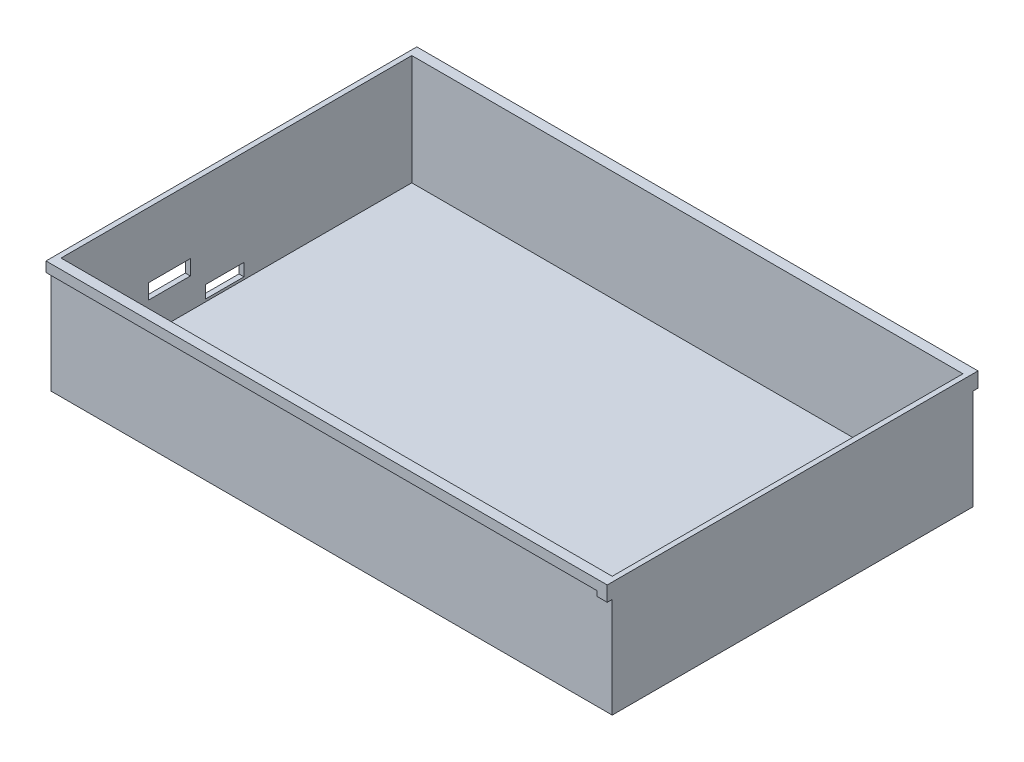
from build123d import *

# Parameters (mm, degrees)
CROQUIS1_W              = 112
CROQUIS1_H              = 72
SALIENTE_EXTRUIR1_DEPTH = 1
SALIENTE_EXTRUIR2_DEPTH = 1
CROQUIS3_W              = 72
CROQUIS3_H              = 23
SALIENTE_EXTRUIR3_DEPTH = 1
CROQUIS4_W              = 112
CROQUIS4_H              = 23
SALIENTE_EXTRUIR4_DEPTH = 1
CROQUIS5_W              = 112
CROQUIS5_H              = 23
SALIENTE_EXTRUIR5_DEPTH = 1
CROQUIS6_W              = 7.7
CROQUIS6_H              = 2.5
CROQUIS6_W_2            = 8.3
CROQUIS6_H_2            = 3
CORTAR_EXTRUIR1_DEPTH   = 1
SALIENTE_EXTRUIR6_DEPTH = 1
SALIENTE_EXTRUIR7_DEPTH = 1


with BuildPart() as part:
    # Croquis1 → Saliente-Extruir1 (new body)
    with BuildSketch(Plane(origin=(0, 0, 0), x_dir=(1, 0, 0), z_dir=(0, 1, 0))):
        with Locations((56, 36)):
            Rectangle(CROQUIS1_W, CROQUIS1_H)
    extrude(amount=SALIENTE_EXTRUIR1_DEPTH)

    # Croquis2 → Saliente-Extruir2 (add)
    with BuildSketch(Plane.ZY):
        Polygon((0, 0), (0, 23), (-72.007399111, 23), (-72, 0), align=None)
    extrude(amount=-SALIENTE_EXTRUIR2_DEPTH)

    # Croquis3 → Saliente-Extruir3 (add)
    with BuildSketch(Plane(origin=(112, 0, 0), x_dir=(0, 0, -1), z_dir=(1, 0, 0))):
        with Locations((36, 11.5)):
            Rectangle(CROQUIS3_W, CROQUIS3_H)
    extrude(amount=-SALIENTE_EXTRUIR3_DEPTH)

    # Croquis4 → Saliente-Extruir4 (add)
    with BuildSketch(Plane.XY):
        with Locations((56, 11.5)):
            Rectangle(CROQUIS4_W, CROQUIS4_H)
    extrude(amount=-SALIENTE_EXTRUIR4_DEPTH)

    # Croquis5 → Saliente-Extruir5 (add)
    with BuildSketch(Plane(origin=(0, 0, -72), x_dir=(-1, 0, 0), z_dir=(0, 0, -1))):
        with Locations((-56, 11.5)):
            Rectangle(CROQUIS5_W, CROQUIS5_H)
    extrude(amount=-SALIENTE_EXTRUIR5_DEPTH)

    # Croquis6 → Cortar-Extruir1 (cut)
    with BuildSketch(Plane.ZY):
        with Locations((-33.65, 2.75)):
            Rectangle(CROQUIS6_W, CROQUIS6_H)
        with Locations((-22.65, 8.5)):
            Rectangle(CROQUIS6_W_2, CROQUIS6_H_2)
    extrude(amount=-CORTAR_EXTRUIR1_DEPTH, mode=Mode.SUBTRACT)

    # Croquis7 → Saliente-Extruir6 (add)
    with BuildSketch(Plane(origin=(0, 0, -72), x_dir=(-1, 0, 0), z_dir=(0, 0, -1))):
        Polygon((-112, 23), (0, 23), (0, 21), (-110, 21), (-110, 20), (-112, 20), align=None)
    extrude(amount=SALIENTE_EXTRUIR6_DEPTH)

    # Croquis8 → Saliente-Extruir7 (add)
    with BuildSketch(Plane.XY):
        Polygon((112, 23), (112, 20), (110, 20), (110, 21), (0, 21), (0, 23), align=None)
    extrude(amount=SALIENTE_EXTRUIR7_DEPTH)


solid = part.part
